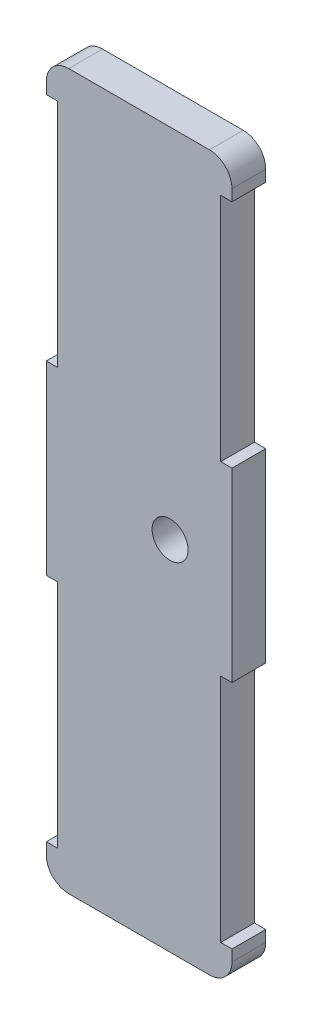
from build123d import *

# Parameters (mm, degrees)
SKETCH1_R           = 1.6
BOSS_EXTRUDE1_DEPTH = 3
FILLET1_R           = 2


with BuildPart() as part:
    # Sketch1 → Boss-Extrude1 (new body)
    with BuildSketch(Plane.XY):
        Polygon((-45.5, 28.75), (-45.5, 8.25), (-44.5, 8.25), (-44.5, -8.25), (-45.5, -8.25), (-45.5, -28.75), (-44.5, -28.75), (-44.5, -31.75), (-61, -31.75), (-61, -28.75), (-60, -28.75), (-60, -8.25), (-61, -8.25), (-61, 8.25), (-60, 8.25), (-60, 28.75), (-61, 28.75), (-61, 31.75), (-44.5, 31.75), (-44.5, 28.75), align=None)
        with Locations((-50, 0)):
            Circle(SKETCH1_R, mode=Mode.SUBTRACT)
    extrude(amount=BOSS_EXTRUDE1_DEPTH)

    # Fillet1
    fillet1_edges = [part.edges().sort_by_distance(p)[0] for p in [
        (-44.5, -31.75, 1.5),
        (-61, -31.75, 1.5),
        (-61, 31.75, 1.5),
        (-44.5, 31.75, 1.5),
    ]]
    fillet(fillet1_edges, radius=FILLET1_R)


solid = part.part
